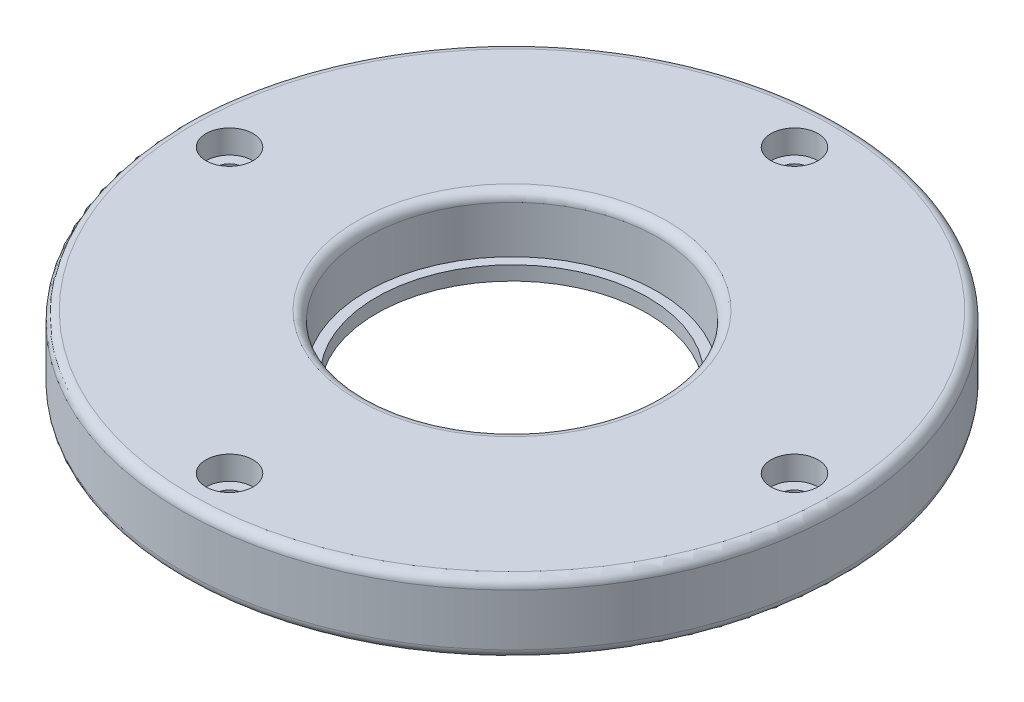
from build123d import *

# Parameters (mm, degrees)
SKETCH2_R                      = 70
BOSS_EXTRUDE1_DEPTH            = 15
SKETCH5_R                      = 30.9
CUT_EXTRUDE1_DEPTH             = 12
SKETCH6_R                      = 28.8
CUT_EXTRUDE2_DEPTH             = 100.719606899
FILLET1_R                      = 2
CBORE_FOR_M5_SHCS1_D           = 5.5
CBORE_FOR_M5_SHCS1_CBORE_D     = 10
CBORE_FOR_M5_SHCS1_CBORE_DEPTH = 5


with BuildPart() as part:
    # Sketch2 → Boss-Extrude1 (new body)
    with BuildSketch(Plane(origin=(0, 0, 0), x_dir=(1, 0, 0), z_dir=(0, 1, 0))):
        with Locations(Location((0, 0, 0), (0, 0, 270))):
            Circle(SKETCH2_R)
    extrude(amount=BOSS_EXTRUDE1_DEPTH)

    # Sketch5 → Cut-Extrude1 (cut)
    with BuildSketch(Plane(origin=(0, 15, 0), x_dir=(1, 0, 0), z_dir=(0, 1, 0))):
        with Locations(Location((0, 0, 0), (0, 0, 270))):
            Circle(SKETCH5_R)
    extrude(amount=-CUT_EXTRUDE1_DEPTH, mode=Mode.SUBTRACT)

    # Sketch6 → Cut-Extrude2 (cut, through all)
    with BuildSketch(Plane(origin=(0, 3, 0), x_dir=(1, 0, 0), z_dir=(0, 1, 0))):
        with Locations(Location((0, 0, 0), (0, 0, 270))):
            Circle(SKETCH6_R)
    extrude(amount=-CUT_EXTRUDE2_DEPTH, mode=Mode.SUBTRACT)

    # Fillet1
    fillet1_edges = [part.edges().sort_by_distance(p)[0] for p in [
        (0, 0, -70),
        (0, 15, -70),
        (0, 15, -30.9),
    ]]
    fillet(fillet1_edges, radius=FILLET1_R)

    # CBORE for M5 SHCS1 (through all)
    with Locations(Plane(origin=(0, 15, 0), x_dir=(1, 0, 0), z_dir=(0, 1, 0))):
        with Locations((0, 60), (60, 0), (-60, 0), (0, -60)):
            CounterBoreHole(CBORE_FOR_M5_SHCS1_D / 2, CBORE_FOR_M5_SHCS1_CBORE_D / 2, CBORE_FOR_M5_SHCS1_CBORE_DEPTH)


solid = part.part
